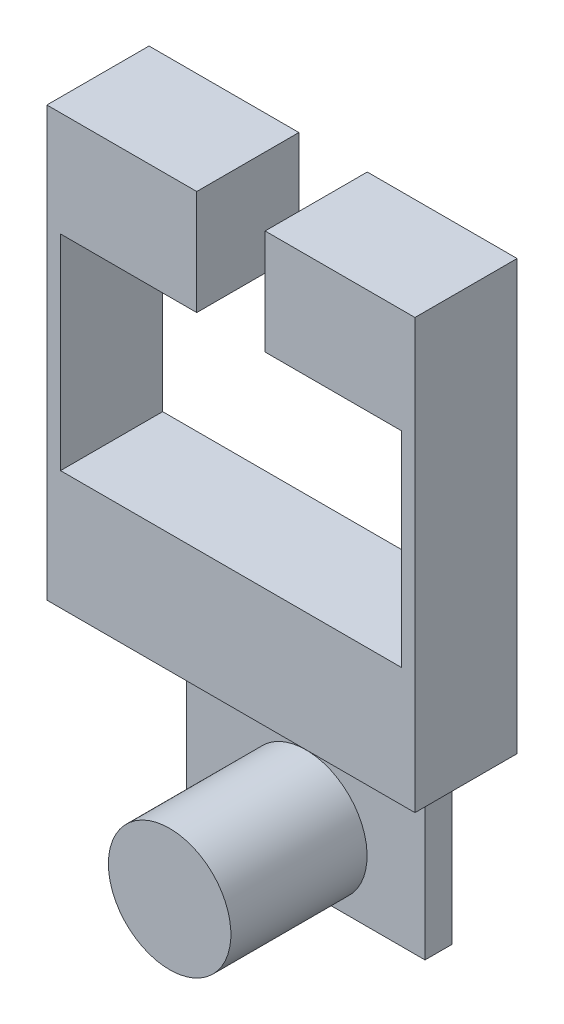
from build123d import *

# Parameters (mm, degrees)
SKETCH1_W            = 68.64096
SKETCH1_H            = 79.975020836
MAIN_BODY_DEPTH      = 9.525
SKETCH2_W            = 63.56096
SKETCH2_H            = 38.227
LOWER_T_CAVITY_DEPTH = 90.088729956
SKETCH3_W            = 12.7508
SKETCH3_H            = 19.558
TOP_SLOT_DEPTH       = 90.088729956
SKETCH4_W            = 44.45
SKETCH4_H            = 36.82365
HANGER_DEPTH         = 5.08
SKETCH5_R            = 11.42365
STRAP_PIN_DEPTH      = 30.48


with BuildPart() as part:
    # Sketch1 → Main-Body (new, symmetric)
    with BuildSketch(Plane.XY):
        with Locations((0, 39.987510418)):
            Rectangle(SKETCH1_W, SKETCH1_H)
    extrude(amount=MAIN_BODY_DEPTH, both=True)

    # Sketch2 → Lower-T-Cavity (cut, through all)
    with BuildSketch(Plane.XY.offset(9.525)):
        with Locations((0, 41.303520836)):
            Rectangle(SKETCH2_W, SKETCH2_H)
    extrude(amount=-LOWER_T_CAVITY_DEPTH, mode=Mode.SUBTRACT)

    # Sketch3 → Top-Slot (cut, through all)
    with BuildSketch(Plane.XY.offset(9.525)):
        with Locations((0, 70.196020836)):
            Rectangle(SKETCH3_W, SKETCH3_H)
    extrude(amount=-TOP_SLOT_DEPTH, mode=Mode.SUBTRACT)

    # Sketch4 → Hanger (add)
    with BuildSketch(Plane(origin=(0, 0, -9.525), x_dir=(-1, 0, 0), z_dir=(0, 0, -1))):
        with Locations((0, -18.411825)):
            Rectangle(SKETCH4_W, SKETCH4_H)
    extrude(amount=-HANGER_DEPTH)

    # Sketch5 → Strap-Pin (add)
    with BuildSketch(Plane(origin=(0, 0, -9.525), x_dir=(-1, 0, 0), z_dir=(0, 0, -1))):
        with Locations((0, -25.4)):
            Circle(SKETCH5_R)
    extrude(amount=-STRAP_PIN_DEPTH)


solid = part.part
